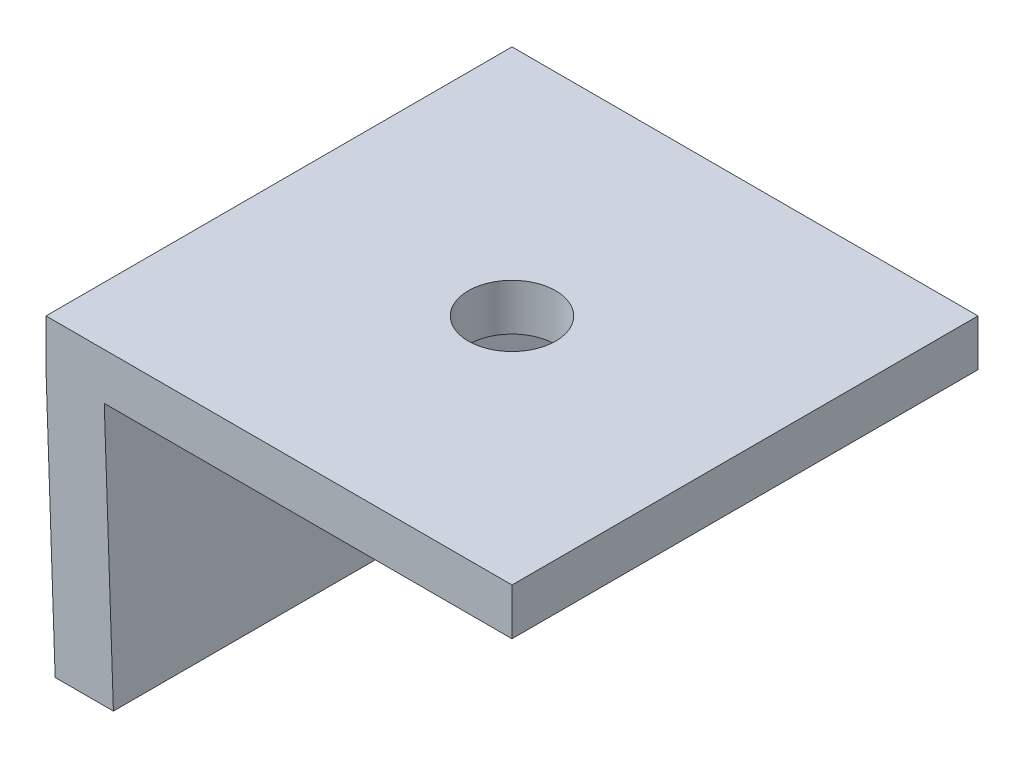
from build123d import *

# Parameters (mm, degrees)
BOSS_EXTRUDE1_DEPTH = 25.4
SKETCH2_W           = 25.4
SKETCH2_H           = 25.4
SKETCH2_R           = 2.38125
BOSS_EXTRUDE2_DEPTH = 2.54
SKETCH3_R           = 3.175
CUT_EXTRUDE1_DEPTH  = 41.148


with BuildPart() as part:
    # Sketch1 → Boss-Extrude1 (new body)
    with BuildSketch(Plane.XY):
        Polygon((0, 0), (3.175, 0), (3.673626559, -14.278796441), (0.498626559, -14.278796441), align=None)
    extrude(amount=BOSS_EXTRUDE1_DEPTH)

    # Sketch2 → Boss-Extrude2 (add)
    with BuildSketch(Plane(origin=(0, 0, 0), x_dir=(1, 0, 0), z_dir=(0, 1, 0))):
        with Locations((12.7, -12.7)):
            Rectangle(SKETCH2_W, SKETCH2_H)
        with Locations(Location((12.7, -12.7, 0), (0, 0, 270))):
            Circle(SKETCH2_R, mode=Mode.SUBTRACT)
    extrude(amount=BOSS_EXTRUDE2_DEPTH)

    # Sketch3 → Cut-Extrude1 (cut)
    with BuildSketch(Plane(origin=(25.4, 0, 0), x_dir=(0, 0, -1), z_dir=(1, 0, 0))):
        with Locations(Location((-12.7, -7.166796441, 0), (0, 0, 270))):
            Circle(SKETCH3_R)
    extrude(amount=-CUT_EXTRUDE1_DEPTH, mode=Mode.SUBTRACT)


solid = part.part
